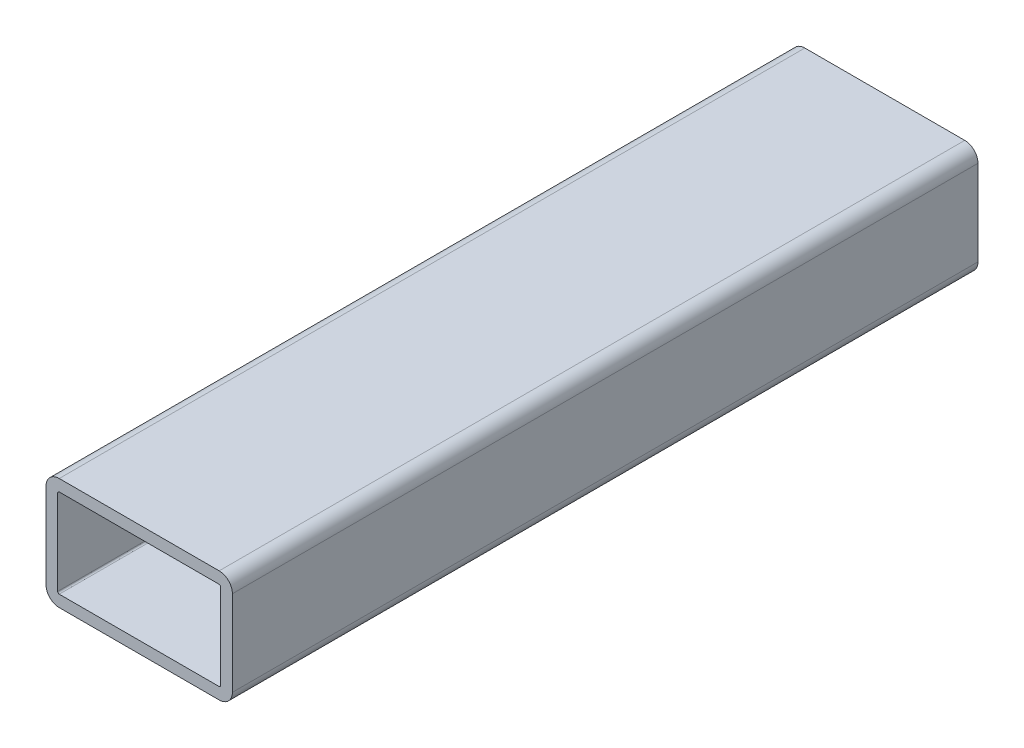
from build123d import *

# Parameters (mm, degrees)
TUBE_SQUARE_TS12X12X0_25_1_DEPTH = 800


with BuildPart() as part:
    # Sketch165 → Tube square TS12X12X0.25(1) (new body)
    with BuildSketch(Plane(origin=(0, 0, -400), x_dir=(0, 1, 0), z_dir=(0, 0, 1))):
        with BuildLine():
            Line((-45.8, -100), (45.8, -100))
            ThreePointArc((45.8, -100), (55.840916293, -95.840916293), (60, -85.8))
            Line((60, -85.8), (60, 85.8))
            ThreePointArc((60, 85.8), (55.840916293, 95.840916293), (45.8, 100))
            Line((45.8, 100), (-45.8, 100))
            ThreePointArc((-45.8, 100), (-55.840916293, 95.840916293), (-60, 85.8))
            Line((-60, 85.8), (-60, -85.8))
            ThreePointArc((-60, -85.8), (-55.840916293, -95.840916293), (-45.8, -100))
        make_face()
        with BuildLine():
            Line((-45.8, -87.5), (45.8, -87.5))
            ThreePointArc((45.8, -87.5), (47.002081528, -87.002081528), (47.5, -85.8))
            Line((47.5, -85.8), (47.5, 85.8))
            ThreePointArc((47.5, 85.8), (47.002081528, 87.002081528), (45.8, 87.5))
            Line((45.8, 87.5), (-45.8, 87.5))
            ThreePointArc((-45.8, 87.5), (-47.002081528, 87.002081528), (-47.5, 85.8))
            Line((-47.5, 85.8), (-47.5, -85.8))
            ThreePointArc((-47.5, -85.8), (-47.002081528, -87.002081528), (-45.8, -87.5))
        make_face(mode=Mode.SUBTRACT)
    extrude(amount=TUBE_SQUARE_TS12X12X0_25_1_DEPTH)


solid = part.part
